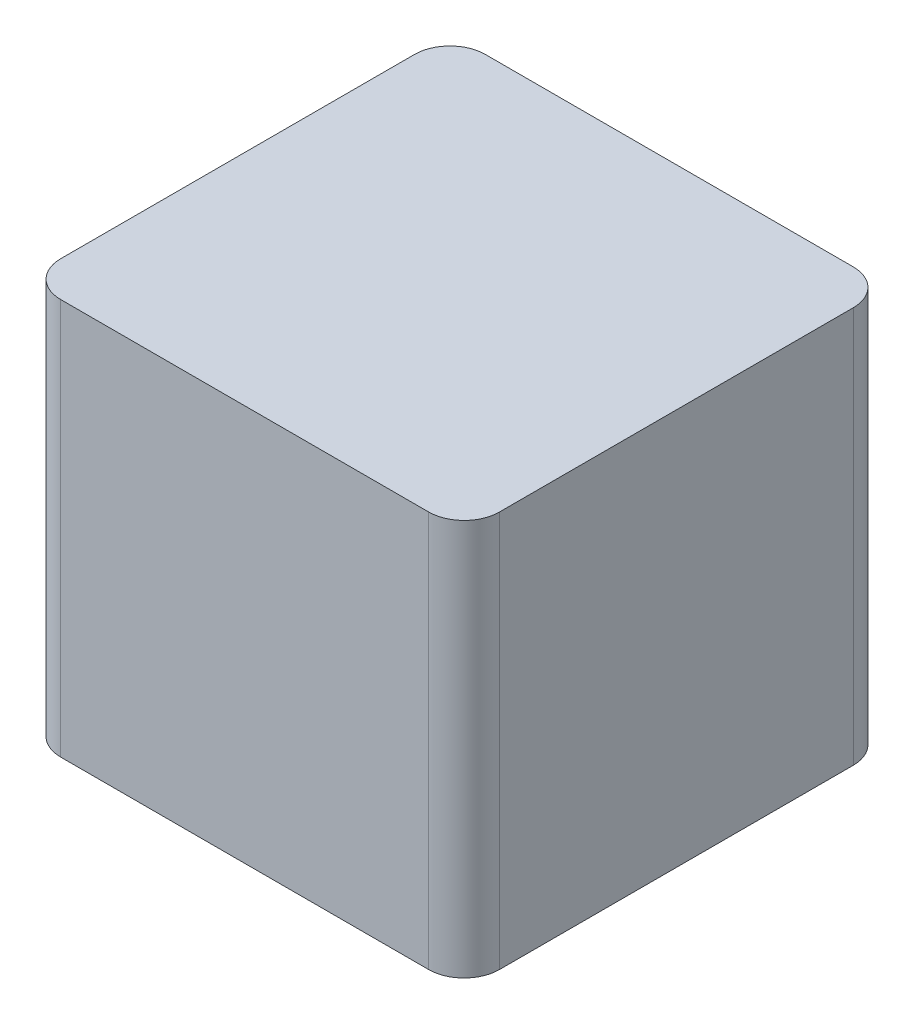
from build123d import *

# Parameters (mm, degrees)
BOSS_EXTRUDE1_DEPTH      = 56
BOSS_EXTRUDE1_DEPTH_BACK = 56


with BuildPart() as part:
    # Sketch1 → Boss-Extrude1 (new, two sides: drawn at the far end of the back side and taken through both)
    with BuildSketch(Plane(origin=(0, 0, 0), x_dir=(1, 0, 0), z_dir=(0, 1, 0)).offset(-BOSS_EXTRUDE1_DEPTH_BACK)):
        with BuildLine():
            Line((-52, -60), (52, -60))
            ThreePointArc((52, -60), (59.071067812, -57.071067812), (62, -50))
            Line((62, -50), (62, 50))
            ThreePointArc((62, 50), (59.071067812, 57.071067812), (52, 60))
            Line((52, 60), (-52, 60))
            ThreePointArc((-52, 60), (-59.071067812, 57.071067812), (-62, 50))
            Line((-62, 50), (-62, -50))
            ThreePointArc((-62, -50), (-59.071067812, -57.071067812), (-52, -60))
        make_face()
    extrude(amount=BOSS_EXTRUDE1_DEPTH + BOSS_EXTRUDE1_DEPTH_BACK)


solid = part.part
